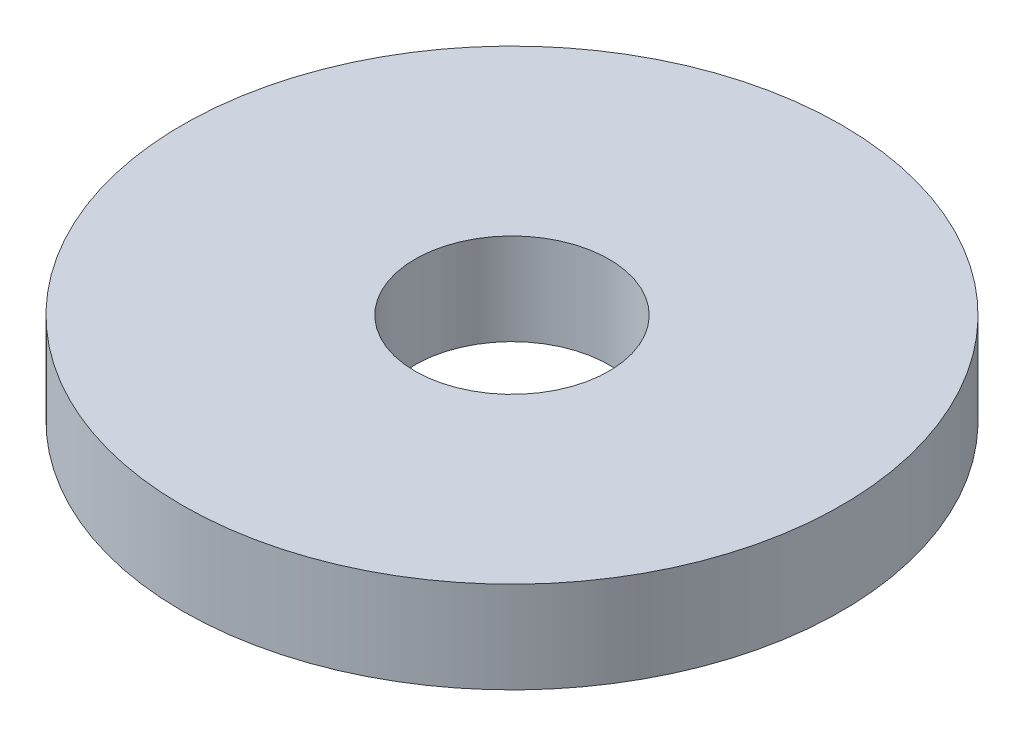
from build123d import *

# Parameters (mm, degrees)
SKETCH1_R           = 9
BOSS_EXTRUDE1_DEPTH = 2.5
SKETCH2_R           = 2.65
CUT_EXTRUDE1_DEPTH  = 13.971121771


with BuildPart() as part:
    # Sketch1 → Boss-Extrude1 (new body)
    with BuildSketch(Plane(origin=(0, 0, 0), x_dir=(1, 0, 0), z_dir=(0, 1, 0))):
        with Locations(Location((0, 0, 0), (0, 0, 270))):
            Circle(SKETCH1_R)
    extrude(amount=BOSS_EXTRUDE1_DEPTH)

    # Sketch2 → Cut-Extrude1 (cut, through all)
    with BuildSketch(Plane(origin=(0, 2.5, 0), x_dir=(1, 0, 0), z_dir=(0, 1, 0))):
        with Locations(Location((0, 0, 0), (0, 0, 270))):
            Circle(SKETCH2_R)
    extrude(amount=-CUT_EXTRUDE1_DEPTH, mode=Mode.SUBTRACT)


solid = part.part
